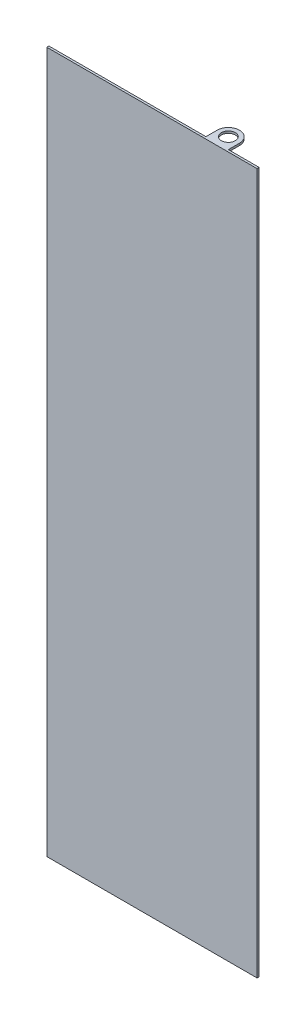
from build123d import *

# Parameters (mm, degrees)
SKETCH2_W           = 150
SKETCH2_H           = 500
BOSS_EXTRUDE1_DEPTH = 1.5
SKETCH3_R           = 5
BOSS_EXTRUDE2_DEPTH = 1.5


with BuildPart() as part:
    # Sketch2 → Boss-Extrude1 (new body)
    with BuildSketch(Plane.XY):
        Rectangle(SKETCH2_W, SKETCH2_H)
    extrude(amount=BOSS_EXTRUDE1_DEPTH)

    # Sketch3 → Boss-Extrude2 (add)
    with BuildSketch(Plane(origin=(0, 250, 0), x_dir=(1, 0, 0), z_dir=(0, 1, 0))):
        with BuildLine():
            Line((37, 0), (37, 8))
            ThreePointArc((37, 8), (45, 16), (53, 8))
            Line((53, 8), (53, 0))
            Line((53, 0), (37, 0))
        make_face()
        with Locations(Location((45, 8, 0), (0, 0, 270))):
            Circle(SKETCH3_R, mode=Mode.SUBTRACT)
    extrude(amount=-BOSS_EXTRUDE2_DEPTH)


solid = part.part
